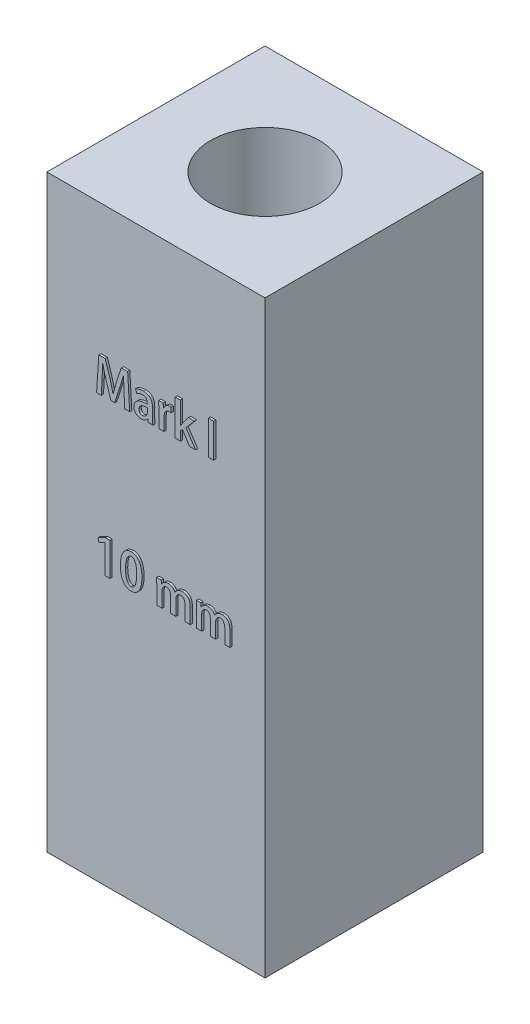
from build123d import *

# Parameters (mm, degrees)
CROQUIS1_W              = 10
CROQUIS1_H              = 10
CROQUIS1_R              = 2.5
SALIENTE_EXTRUIR1_DEPTH = 27
CROQUIS2_2_W            = 0.238171994
CROQUIS2_2_H            = 1.552222223
SALIENTE_EXTRUIR2_DEPTH = 0.1


with BuildPart() as part:
    # Croquis1 → Saliente-Extruir1 (new body)
    with BuildSketch(Plane(origin=(0, 0, 0), x_dir=(1, 0, 0), z_dir=(0, 1, 0))):
        Rectangle(CROQUIS1_W, CROQUIS1_H)
        Circle(CROQUIS1_R, mode=Mode.SUBTRACT)
    extrude(amount=SALIENTE_EXTRUIR1_DEPTH)

    # Croquis2<2> → Saliente-Extruir2 (add)
    # profile 1 of 9: a face of its own
    with BuildSketch(Plane.XY.offset(5)):
        with BuildLine():
            Line((-1.196299168, 21.029080524), (-1.489029741, 21.029080524))
            Line((-1.489029741, 21.029080524), (-1.713120041, 20.346907093))
            add(Edge.make_bspline(
                [(-1.713120041, 20.346907093), (-1.727697615, 20.299716085), (-1.756231951, 20.207343783), (-1.795341625, 20.070753521), (-1.829992127, 19.939079232), (-1.850660973, 19.852657221), (-1.860771731, 19.810381416)],
                knots=[0, 0, 0, 0, 1.06482216, 2.08429696, 3.06287894, 4, 4, 4, 4], degree=3))
            Line((-1.860771731, 19.810381416), (-1.866551238, 19.810381416))
            add(Edge.make_bspline(
                [(-1.866551238, 19.810381416), (-1.876481422, 19.853051166), (-1.896683618, 19.939859498), (-1.93070374, 20.071488595), (-1.967459767, 20.207101232), (-1.994351955, 20.298408277), (-2.008015817, 20.344801184)],
                knots=[0, 0, 0, 0, 0.950771496, 1.934271678, 2.950408035, 4, 4, 4, 4], degree=3))
            Line((-2.008015817, 20.344801184), (-2.225903251, 21.029080524))
            Line((-2.225903251, 21.029080524), (-2.516614993, 21.029080524))
            Line((-2.516614993, 21.029080524), (-2.621630897, 19.479409339))
            Line((-2.621630897, 19.479409339), (-2.403560427, 19.479409339))
            Line((-2.403560427, 19.479409339), (-2.36924029, 20.115225551))
            add(Edge.make_bspline(
                [(-2.36924029, 20.115225551), (-2.366142688, 20.170919846), (-2.35989255, 20.283296133), (-2.353809897, 20.423803434), (-2.348367501, 20.535729765), (-2.345730048, 20.61699773), (-2.342790327, 20.695298568), (-2.341738393, 20.746445045), (-2.341221555, 20.771574379)],
                knots=[0, 0, 0, 0, 1.528265809, 3.083634274, 3.853229214, 4.59840858, 5.311368824, 6, 6, 6, 6], degree=3))
            Line((-2.341221555, 20.771574379), (-2.334920154, 20.771597581))
            add(Edge.make_bspline(
                [(-2.334920154, 20.771597581), (-2.324589296, 20.723617077), (-2.303631025, 20.626278754), (-2.266531143, 20.479508668), (-2.225758304, 20.329473172), (-2.195122831, 20.22906041), (-2.179605039, 20.178198314)],
                knots=[0, 0, 0, 0, 0.959753872, 1.947058171, 2.960122984, 4, 4, 4, 4], degree=3))
            Line((-2.179605039, 20.178198314), (-1.967492815, 19.493601312))
            Line((-1.967492815, 19.493601312), (-1.791854471, 19.493601312))
            Line((-1.791854471, 19.493601312), (-1.561707676, 20.192452732))
            add(Edge.make_bspline(
                [(-1.561707676, 20.192452732), (-1.545557325, 20.241909213), (-1.513574545, 20.339848618), (-1.469197981, 20.486028271), (-1.427941936, 20.629553544), (-1.402746733, 20.724599981), (-1.390294614, 20.771574379)],
                knots=[0, 0, 0, 0, 1.033513873, 2.046682856, 3.034620343, 4, 4, 4, 4], degree=3))
            Line((-1.390294614, 20.771574379), (-1.384050501, 20.771597581))
            add(Edge.make_bspline(
                [(-1.384050501, 20.771597581), (-1.384147418, 20.746657815), (-1.384345026, 20.695806648), (-1.383338746, 20.618262138), (-1.381707988, 20.538078238), (-1.377545118, 20.428380993), (-1.371719332, 20.291107159), (-1.366485475, 20.18142271), (-1.363896272, 20.12716152)],
                knots=[0, 0, 0, 0, 0.69615936, 1.419440619, 2.164688967, 2.934803833, 4.483639269, 6, 6, 6, 6], degree=3))
            Line((-1.363896272, 20.12716152), (-1.32954205, 19.479409339))
            Line((-1.32954205, 19.479409339), (-1.103432918, 19.479409339))
            Line((-1.103432918, 19.479409339), (-1.196299168, 21.029080524))
        make_face()
    # profile 2 of 9: a face of its own
    with BuildSketch(Plane.XY.offset(5)):
        with BuildLine():
            add(Edge.make_bspline(
                [(-0.053952166, 20.155506797), (-0.053933683, 20.171094279), (-0.053897286, 20.201789221), (-0.057518774, 20.247008773), (-0.063893546, 20.290439821), (-0.073214651, 20.332080632), (-0.085936266, 20.371763587), (-0.101413142, 20.409687835), (-0.120056057, 20.445711117), (-0.141545368, 20.479861857), (-0.167086723, 20.511273005), (-0.197339407, 20.538867014), (-0.232386885, 20.562185402), (-0.272154981, 20.581216365), (-0.316470833, 20.596407), (-0.365308531, 20.607712644), (-0.418720262, 20.615108287), (-0.45586616, 20.61654487), (-0.475152092, 20.617290736)],
                knots=[0, 0, 0, 0, 1.04529413, 2.058397975, 3.039753549, 3.988049356, 4.917306062, 5.832005784, 6.732558164, 7.634995369, 8.534400609, 9.439717093, 10.371077683, 11.347885902, 12.389132223, 13.507522911, 14.705920534, 16, 16, 16, 16], degree=3))
            add(Edge.make_bspline(
                [(-0.475152092, 20.617290736), (-0.492957595, 20.616816764), (-0.528048962, 20.615882654), (-0.579600467, 20.61088989), (-0.629120436, 20.602765232), (-0.676037595, 20.591206125), (-0.720086934, 20.577835591), (-0.760725874, 20.56297161), (-0.797576215, 20.546416367), (-0.820085609, 20.533481991), (-0.830943079, 20.527243058)],
                knots=[0, 0, 0, 0, 1.151566781, 2.269526023, 3.346377101, 4.393757963, 5.391790339, 6.321988655, 7.190606464, 8, 8, 8, 8], degree=3))
            Line((-0.830943079, 20.527243058), (-0.781123083, 20.369063254))
            add(Edge.make_bspline(
                [(-0.781123083, 20.369063254), (-0.77171247, 20.37510656), (-0.75272953, 20.387297021), (-0.722239537, 20.403059962), (-0.690103274, 20.417263833), (-0.656139477, 20.428702506), (-0.621351216, 20.438541683), (-0.585956767, 20.445552861), (-0.550147937, 20.449783122), (-0.526200151, 20.450385225), (-0.514162975, 20.450687867)],
                knots=[0, 0, 0, 0, 0.947728913, 1.911743672, 2.906591377, 3.923705885, 4.947352295, 5.969890554, 6.979580645, 8, 8, 8, 8], degree=3))
            add(Edge.make_bspline(
                [(-0.514162975, 20.450687867), (-0.501813894, 20.449873349), (-0.478242904, 20.448318659), (-0.444972946, 20.442010936), (-0.415449317, 20.43362517), (-0.389446639, 20.42296027), (-0.367418177, 20.408938358), (-0.348994114, 20.39252782), (-0.334418974, 20.373321038), (-0.321472296, 20.344609444), (-0.310378364, 20.308152502), (-0.300596189, 20.265632707), (-0.296081909, 20.224913524), (-0.297364519, 20.198636491), (-0.297989886, 20.185824502)],
                knots=[0, 0, 0, 0, 1.124941475, 2.147203117, 3.073276344, 3.914150165, 4.693859246, 5.436944029, 6.148486199, 6.868538222, 8.288979618, 9.609682438, 10.834544209, 12, 12, 12, 12], degree=3))
            add(Edge.make_bspline(
                [(-0.297989886, 20.185824502), (-0.320678653, 20.185539999), (-0.365025123, 20.184983922), (-0.429782822, 20.180745531), (-0.490876774, 20.172779945), (-0.548357177, 20.161890924), (-0.60242818, 20.148446821), (-0.652727709, 20.130932907), (-0.699627981, 20.11078697), (-0.742785665, 20.087455124), (-0.78181461, 20.060849193), (-0.815831886, 20.03054531), (-0.844514985, 19.996643678), (-0.868702711, 19.959781778), (-0.887106432, 19.919009882), (-0.900985991, 19.875142448), (-0.90956491, 19.827714103), (-0.911105263, 19.794968866), (-0.911897994, 19.778116776)],
                knots=[0, 0, 0, 0, 1.312583045, 2.565517338, 3.751913568, 4.874585872, 5.948775456, 6.97196923, 7.952367169, 8.899011352, 9.80588498, 10.679130641, 11.525793372, 12.368308044, 13.221239438, 14.104974037, 15.024739096, 16, 16, 16, 16], degree=3))
            add(Edge.make_bspline(
                [(-0.911897994, 19.778116776), (-0.911473645, 19.767156476), (-0.910641021, 19.745651047), (-0.906633242, 19.713979761), (-0.899372869, 19.68374055), (-0.890222197, 19.654513549), (-0.877670348, 19.62680416), (-0.862708273, 19.600423672), (-0.845267409, 19.575176501), (-0.825103672, 19.551624148), (-0.802677089, 19.5297669), (-0.777493306, 19.511004679), (-0.750365313, 19.494799783), (-0.721140808, 19.481133874), (-0.689496917, 19.470690929), (-0.655746236, 19.462757034), (-0.61969828, 19.457773568), (-0.594937614, 19.456639732), (-0.582212035, 19.456057004)],
                knots=[0, 0, 0, 0, 1.019558823, 2.000497171, 2.961865832, 3.90763667, 4.843526869, 5.78386522, 6.724423229, 7.691661655, 8.662438953, 9.629634663, 10.603980382, 11.596308817, 12.622532153, 13.696327026, 14.81604254, 16, 16, 16, 16], degree=3))
            add(Edge.make_bspline(
                [(-0.582212035, 19.456057004), (-0.565841961, 19.456612545), (-0.533867175, 19.457697653), (-0.487707844, 19.466370755), (-0.444274735, 19.478668363), (-0.404395551, 19.496746116), (-0.368185088, 19.518848134), (-0.335215096, 19.543532898), (-0.306123182, 19.571455519), (-0.289918348, 19.592526447), (-0.281857566, 19.603007774)],
                knots=[0, 0, 0, 0, 1.130657597, 2.208452709, 3.237069398, 4.244418774, 5.223812689, 6.164576675, 7.087004055, 8, 8, 8, 8], degree=3))
            Line((-0.281857566, 19.603007774), (-0.275253111, 19.603065349))
            Line((-0.275253111, 19.603065349), (-0.258392086, 19.477618228))
            Line((-0.258392086, 19.477618228), (-0.037732768, 19.477618228))
            add(Edge.make_bspline(
                [(-0.037732768, 19.477618228), (-0.040897849, 19.496597162), (-0.047581659, 19.536675639), (-0.051747532, 19.600214154), (-0.05403103, 19.668395576), (-0.054172931, 19.715246615), (-0.054245195, 19.739105893)],
                knots=[0, 0, 0, 0, 0.879539962, 1.857355241, 2.908840502, 4, 4, 4, 4], degree=3))
            Line((-0.054245195, 19.739105893), (-0.053952166, 20.155506797))
        make_face()
        with BuildLine():
            add(Edge.make_bspline(
                [(-0.292123874, 19.85181673), (-0.292565708, 19.843563522), (-0.293425459, 19.827503836), (-0.297118337, 19.804055524), (-0.302157272, 19.781770952), (-0.30974875, 19.760760078), (-0.318698035, 19.74068664), (-0.329992125, 19.721921664), (-0.342912234, 19.704123049), (-0.357899957, 19.687847624), (-0.374138828, 19.672946445), (-0.391614279, 19.660011148), (-0.409781112, 19.64873434), (-0.42910308, 19.639619265), (-0.449388406, 19.632186668), (-0.470747733, 19.627011652), (-0.493045123, 19.623714024), (-0.508187646, 19.623016293), (-0.515922865, 19.622659873)],
                knots=[0, 0, 0, 0, 1.1127689, 2.165305488, 3.194083487, 4.185588777, 5.169981375, 6.15040018, 7.13046498, 8.12816315, 9.12586132, 10.095335325, 11.053196287, 12.001774197, 12.968470205, 13.958837393, 14.957317833, 16, 16, 16, 16], degree=3))
            add(Edge.make_bspline(
                [(-0.515922865, 19.622659873), (-0.526348867, 19.622986841), (-0.54677129, 19.623627305), (-0.576043385, 19.632361798), (-0.60296697, 19.646059855), (-0.627344866, 19.665200397), (-0.647756744, 19.69069521), (-0.66238159, 19.722675436), (-0.671428419, 19.760622731), (-0.672737046, 19.787936502), (-0.673432972, 19.802461914)],
                knots=[0, 0, 0, 0, 0.925162071, 1.812204857, 2.691873356, 3.602553412, 4.549923018, 5.56994314, 6.707700436, 8, 8, 8, 8], degree=3))
            add(Edge.make_bspline(
                [(-0.673432972, 19.802461914), (-0.672504166, 19.814124606), (-0.670710258, 19.836650073), (-0.664133484, 19.868903199), (-0.653394707, 19.897940713), (-0.639623735, 19.923993766), (-0.622452724, 19.947140376), (-0.60120143, 19.966485377), (-0.576944474, 19.983265842), (-0.53961783, 20.000360001), (-0.489300298, 20.016507544), (-0.426242327, 20.030369907), (-0.360162716, 20.037877182), (-0.315313119, 20.037760195), (-0.292416903, 20.037700472)],
                knots=[0, 0, 0, 0, 0.831751151, 1.606454387, 2.332498033, 3.02628555, 3.696675427, 4.370806108, 5.061344671, 5.786088267, 7.281491765, 8.811961156, 10.372470837, 12, 12, 12, 12], degree=3))
            Line((-0.292416903, 20.037700472), (-0.292123874, 19.85181673))
        make_face(mode=Mode.SUBTRACT)
    # profile 3 of 9: a face of its own
    with BuildSketch(Plane.XY.offset(5)):
        with BuildLine():
            add(Edge.make_bspline(
                [(0.798083824, 20.611553336), (0.788539911, 20.613210649), (0.769047446, 20.61659554), (0.749267113, 20.617055819), (0.739171639, 20.617290736)],
                knots=[0, 0, 0, 0, 0.97924127, 2, 2, 2, 2], degree=3))
            add(Edge.make_bspline(
                [(0.739171639, 20.617290736), (0.723847826, 20.616453707), (0.693455305, 20.614793584), (0.648964014, 20.602845287), (0.606665471, 20.583392189), (0.566554279, 20.557213359), (0.529366688, 20.524773207), (0.497456952, 20.485421616), (0.469512451, 20.440761818), (0.456024619, 20.407616391), (0.449083192, 20.39055831)],
                knots=[0, 0, 0, 0, 0.938175605, 1.860732817, 2.801619752, 3.780189859, 4.786007179, 5.811395864, 6.873648904, 8, 8, 8, 8], degree=3))
            Line((0.449083192, 20.39055831), (0.440870375, 20.390609296))
            Line((0.440870375, 20.390609296), (0.432657557, 20.593479237))
            Line((0.432657557, 20.593479237), (0.225386747, 20.593479237))
            add(Edge.make_bspline(
                [(0.225386747, 20.593479237), (0.226735788, 20.567494093), (0.229489608, 20.514450168), (0.231570538, 20.432608946), (0.233218682, 20.345688049), (0.233208637, 20.28584588), (0.233203418, 20.254753506)],
                knots=[0, 0, 0, 0, 0.921405029, 1.880880017, 2.898962507, 4, 4, 4, 4], degree=3))
            Line((0.233203418, 20.254753506), (0.233496446, 19.478268161))
            Line((0.233496446, 19.478268161), (0.47166844, 19.478268161))
            Line((0.47166844, 19.478268161), (0.47166844, 20.070276186))
            add(Edge.make_bspline(
                [(0.47166844, 20.070276186), (0.472033638, 20.082301823), (0.47274468, 20.105715785), (0.475848675, 20.139945871), (0.481442585, 20.172189381), (0.489050183, 20.202603479), (0.498765514, 20.231145838), (0.510353047, 20.258001793), (0.524589729, 20.282599339), (0.540410607, 20.305428882), (0.558265096, 20.325823855), (0.577615533, 20.344024212), (0.599106245, 20.358987052), (0.621896445, 20.371773551), (0.646567142, 20.381305855), (0.672514788, 20.388861822), (0.700215782, 20.393190292), (0.719212277, 20.393972346), (0.728905617, 20.394371404)],
                knots=[0, 0, 0, 0, 1.241840886, 2.417868999, 3.544527356, 4.616704577, 5.650820151, 6.654086497, 7.630544836, 8.5797601, 9.516878827, 10.423948895, 11.314471818, 12.213419717, 13.114913654, 14.038234368, 14.998969914, 16, 16, 16, 16], degree=3))
            add(Edge.make_bspline(
                [(0.728905617, 20.394371404), (0.741154195, 20.394190832), (0.764272582, 20.393850016), (0.787101102, 20.390214468), (0.797834621, 20.388505106)],
                knots=[0, 0, 0, 0, 1.059639438, 2, 2, 2, 2], degree=3))
            Line((0.797834621, 20.388505106), (0.798083824, 20.611553336))
        make_face()
    # profile 4 of 9: a face of its own
    with BuildSketch(Plane.XY.offset(5)):
        with BuildLine():
            Line((1.473955281, 20.134031505), (1.867275682, 20.594647054))
            Line((1.867275682, 20.594647054), (1.589518491, 20.594647054))
            Line((1.589518491, 20.594647054), (1.311761301, 20.221284671))
            add(Edge.make_bspline(
                [(1.311761301, 20.221284671), (1.297091766, 20.200201073), (1.267485244, 20.157649487), (1.240155846, 20.113600536), (1.226367706, 20.091377101)],
                knots=[0, 0, 0, 0, 0.99096644, 2, 2, 2, 2], degree=3))
            Line((1.226367706, 20.091377101), (1.222554612, 20.091419494))
            Line((1.222554612, 20.091419494), (1.222554612, 21.103899887))
            Line((1.222554612, 21.103899887), (0.984382618, 21.103899887))
            Line((0.984382618, 21.103899887), (0.984382618, 19.476589047))
            Line((0.984382618, 19.476589047), (1.222554612, 19.476589047))
            Line((1.222554612, 19.476589047), (1.222554612, 19.878359438))
            Line((1.222554612, 19.878359438), (1.313788726, 19.989962325))
            Line((1.313788726, 19.989962325), (1.634121836, 19.476589047))
            Line((1.634121836, 19.476589047), (1.9179613, 19.476589047))
            Line((1.9179613, 19.476589047), (1.473955281, 20.134031505))
        make_face()
    # profile 5 of 9: a face of its own
    with BuildSketch(Plane.XY.offset(5)):
        with Locations((2.624013114, 20.252700159)):
            Rectangle(CROQUIS2_2_W, CROQUIS2_2_H)
    # profile 6 of 9: a face of its own
    with BuildSketch(Plane.XY.offset(5)):
        Polygon((-2.006255927, 12.406347497), (-2.006255927, 13.92454519), (-2.212803475, 13.92454519), (-2.558678757, 13.749288098), (-2.505965713, 13.578477993), (-2.248482771, 13.720397725), (-2.244427921, 13.720397725), (-2.244427921, 12.408653915), align=None)
    # profile 7 of 9: a face of its own
    with BuildSketch(Plane.XY.offset(5)):
        with BuildLine():
            add(Edge.make_bspline(
                [(-1.042610748, 12.388015029), (-1.023441122, 12.388668567), (-0.98588999, 12.389948775), (-0.931195762, 12.399835728), (-0.879832101, 12.415978098), (-0.831710785, 12.438457433), (-0.787149685, 12.467554445), (-0.745721165, 12.502799553), (-0.707814724, 12.5444702), (-0.673440827, 12.592376919), (-0.642631058, 12.646208836), (-0.616009253, 12.706103224), (-0.593480897, 12.771790365), (-0.575218335, 12.843342421), (-0.560533813, 12.920721581), (-0.550241449, 13.003998439), (-0.54368267, 13.093088936), (-0.542784248, 13.154386241), (-0.542321207, 13.18597853)],
                knots=[0, 0, 0, 0, 0.870696281, 1.705595656, 2.516350062, 3.311357778, 4.111130694, 4.927465531, 5.776524699, 6.664348225, 7.60171378, 8.590083443, 9.638235951, 10.753539253, 11.94293492, 13.214798286, 14.564522568, 16, 16, 16, 16], degree=3))
            add(Edge.make_bspline(
                [(-0.542321207, 13.18597853), (-0.542584319, 13.214734989), (-0.543096817, 13.270747529), (-0.549224638, 13.352378809), (-0.558456615, 13.429549109), (-0.571347645, 13.502240199), (-0.588912941, 13.570340702), (-0.609456747, 13.634097802), (-0.634118318, 13.693294542), (-0.662482618, 13.747689511), (-0.694461981, 13.796910593), (-0.730845348, 13.839750764), (-0.77061279, 13.876637806), (-0.814472061, 13.906850978), (-0.862176087, 13.930571221), (-0.913765931, 13.94746045), (-0.968924349, 13.958640941), (-1.007072872, 13.960534622), (-1.026584125, 13.961503155)],
                knots=[0, 0, 0, 0, 1.348598241, 2.626833012, 3.837323855, 4.993252023, 6.086653137, 7.133754439, 8.132822275, 9.090804279, 10.007900934, 10.879914043, 11.720575117, 12.54490278, 13.369396272, 14.210545074, 15.084774353, 16, 16, 16, 16], degree=3))
            add(Edge.make_bspline(
                [(-1.026584125, 13.961503155), (-1.045987332, 13.96069907), (-1.083880009, 13.959128768), (-1.138990672, 13.948938037), (-1.190724204, 13.9325674), (-1.239070521, 13.909414026), (-1.283926186, 13.879755999), (-1.325636708, 13.843916915), (-1.363842335, 13.801671798), (-1.398421154, 13.753228797), (-1.429551012, 13.699139804), (-1.456413506, 13.639333002), (-1.47929517, 13.574170719), (-1.497937263, 13.50362709), (-1.512389609, 13.427738432), (-1.523320041, 13.34658507), (-1.52960997, 13.25989336), (-1.530777696, 13.200263055), (-1.531379086, 13.169552895)],
                knots=[0, 0, 0, 0, 0.885786215, 1.729858878, 2.550092024, 3.356753299, 4.168966232, 4.998392219, 5.861110803, 6.763026954, 7.71096382, 8.705887709, 9.752087664, 10.860900304, 12.034055661, 13.277157086, 14.597710659, 16, 16, 16, 16], degree=3))
            add(Edge.make_bspline(
                [(-1.531379086, 13.169552895), (-1.531024787, 13.140501089), (-1.530334433, 13.083893558), (-1.523823588, 13.001301514), (-1.514580324, 12.923279856), (-1.500677711, 12.849926102), (-1.483217094, 12.781192564), (-1.461876762, 12.716876964), (-1.436366053, 12.657370431), (-1.407435614, 12.602518435), (-1.374788202, 12.55315179), (-1.33826174, 12.509807714), (-1.297811719, 12.47309317), (-1.253640109, 12.442931612), (-1.2061139, 12.418783845), (-1.154739847, 12.401972103), (-1.09999629, 12.390696937), (-1.062132522, 12.388827356), (-1.042610748, 12.388015029)],
                knots=[0, 0, 0, 0, 1.353423849, 2.637150346, 3.858261108, 5.012665895, 6.113189956, 7.160539399, 8.16670341, 9.126620219, 10.046469106, 10.919123896, 11.760946034, 12.583565319, 13.404631502, 14.235884548, 15.095383165, 16, 16, 16, 16], degree=3))
        make_face()
        with BuildLine():
            add(Edge.make_bspline(
                [(-1.038573658, 12.572510681), (-1.048520509, 12.573047376), (-1.068139332, 12.574105934), (-1.096395981, 12.582519637), (-1.122978599, 12.595205927), (-1.147481539, 12.613225166), (-1.170301727, 12.63584659), (-1.191135695, 12.663490546), (-1.210091031, 12.695964331), (-1.227265481, 12.7330526), (-1.242721118, 12.774433898), (-1.256232578, 12.819987548), (-1.267108258, 12.869749213), (-1.276551525, 12.923455483), (-1.283773791, 12.981313842), (-1.28895721, 13.043155672), (-1.292234462, 13.109095014), (-1.292682768, 13.154394313), (-1.292914064, 13.177765713)],
                knots=[0, 0, 0, 0, 0.666398031, 1.31438028, 1.962893771, 2.634846584, 3.344681637, 4.112349672, 4.950647476, 5.86347927, 6.851779693, 7.912578033, 9.049075701, 10.267961701, 11.570849897, 12.960254545, 14.431695278, 16, 16, 16, 16], degree=3))
            add(Edge.make_bspline(
                [(-1.292914064, 13.177765713), (-1.292622709, 13.201140128), (-1.292056668, 13.246551624), (-1.287981905, 13.312465532), (-1.282740373, 13.374255788), (-1.274711836, 13.431780399), (-1.265042841, 13.4852283), (-1.252529034, 13.534301133), (-1.238743865, 13.579446585), (-1.222273133, 13.620178048), (-1.204303884, 13.656579804), (-1.184611463, 13.688271914), (-1.16346553, 13.715241355), (-1.140869395, 13.737593209), (-1.116482995, 13.754937469), (-1.090622914, 13.767415547), (-1.063236138, 13.775492128), (-1.044335859, 13.776499605), (-1.034796942, 13.777008076)],
                knots=[0, 0, 0, 0, 1.581052361, 3.071646956, 4.466225399, 5.774778899, 6.999321057, 8.13822646, 9.198772947, 10.189899711, 11.106816715, 11.941785511, 12.709246862, 13.420164871, 14.084452052, 14.723397775, 15.355702508, 16, 16, 16, 16], degree=3))
            add(Edge.make_bspline(
                [(-1.034796942, 13.777008076), (-1.024082287, 13.776313321), (-1.003022702, 13.774947785), (-0.972800728, 13.76638471), (-0.944707798, 13.753432307), (-0.919139232, 13.735056947), (-0.895875205, 13.711930723), (-0.874952704, 13.683869193), (-0.856144601, 13.651087368), (-0.840064855, 13.613438621), (-0.82572754, 13.57175489), (-0.813621983, 13.526216041), (-0.802984744, 13.477106406), (-0.794595266, 13.42431815), (-0.788268821, 13.367833695), (-0.783551842, 13.307772841), (-0.780983975, 13.243979965), (-0.780659703, 13.20025537), (-0.780492914, 13.177765713)],
                knots=[0, 0, 0, 0, 0.720966059, 1.417054204, 2.100078545, 2.793954457, 3.524557493, 4.299796832, 5.143005199, 6.062454772, 7.05102079, 8.107851098, 9.232113941, 10.431958672, 11.703767055, 13.056962832, 14.486254779, 16, 16, 16, 16], degree=3))
            add(Edge.make_bspline(
                [(-0.780492914, 13.177765713), (-0.780469731, 13.157623598), (-0.780424139, 13.118012006), (-0.782427144, 13.059597367), (-0.786575172, 13.003450871), (-0.792318735, 12.949510785), (-0.800312724, 12.897865092), (-0.809918226, 12.848335321), (-0.821287445, 12.801007253), (-0.834591758, 12.756349983), (-0.849863906, 12.715214572), (-0.868505802, 12.679000781), (-0.889548341, 12.647756022), (-0.913810531, 12.621747233), (-0.941170121, 12.601388606), (-0.970905635, 12.585635814), (-1.003833642, 12.575863343), (-1.026815962, 12.573550594), (-1.038573658, 12.572510681)],
                knots=[0, 0, 0, 0, 1.341939408, 2.639065411, 3.893110861, 5.09230624, 6.252216656, 7.373906837, 8.453023627, 9.493766498, 10.477323239, 11.371762395, 12.201113983, 12.97990739, 13.729039495, 14.463267275, 15.211379073, 16, 16, 16, 16], degree=3))
        make_face(mode=Mode.SUBTRACT)
    # profile 8 of 9: a face of its own
    with BuildSketch(Plane.XY.offset(5)):
        with BuildLine():
            add(Edge.make_bspline(
                [(1.673086029, 13.090464425), (1.67215772, 13.111077003), (1.670365963, 13.150861952), (1.663815589, 13.208116919), (1.654840245, 13.260791645), (1.641836074, 13.308435454), (1.626213175, 13.351330131), (1.607054541, 13.389270084), (1.584725268, 13.42252538), (1.55905493, 13.450782133), (1.531172757, 13.474285603), (1.502990684, 13.495127157), (1.473861975, 13.512414251), (1.444116532, 13.526724485), (1.413415931, 13.53741003), (1.381877872, 13.544208935), (1.34978937, 13.548726162), (1.328163308, 13.548586131), (1.317295329, 13.54851576)],
                knots=[0, 0, 0, 0, 1.513261231, 2.920790482, 4.225039661, 5.429095985, 6.538902965, 7.568588871, 8.539409605, 9.468669045, 10.358677973, 11.210859535, 12.037483604, 12.839564471, 13.628941055, 14.4154775, 15.203712731, 16, 16, 16, 16], degree=3))
            add(Edge.make_bspline(
                [(1.317295329, 13.54851576), (1.298079599, 13.547757116), (1.260829637, 13.546286475), (1.207305651, 13.535705198), (1.157840201, 13.519457225), (1.112968522, 13.495943442), (1.072406348, 13.466676206), (1.034744112, 13.433531571), (1.00106113, 13.395010462), (0.981834694, 13.366489389), (0.972063678, 13.35199477)],
                knots=[0, 0, 0, 0, 1.108126197, 2.148118191, 3.136426768, 4.10280475, 5.057637098, 6.016626622, 6.992035069, 8, 8, 8, 8], degree=3))
            Line((0.972063678, 13.35199477), (0.968006824, 13.352002217))
            add(Edge.make_bspline(
                [(0.968006824, 13.352002217), (0.961392471, 13.366707133), (0.948448558, 13.39548382), (0.921685547, 13.434177719), (0.890103124, 13.46783246), (0.853781486, 13.49650351), (0.813254282, 13.519473905), (0.768881432, 13.535897487), (0.721292811, 13.546591562), (0.688291365, 13.547864722), (0.671415895, 13.54851576)],
                knots=[0, 0, 0, 0, 1.020955632, 1.99795227, 2.96752067, 3.938931661, 4.92195175, 5.909051468, 6.930781959, 8, 8, 8, 8], degree=3))
            add(Edge.make_bspline(
                [(0.671415895, 13.54851576), (0.6521002, 13.547449292), (0.61511286, 13.545407129), (0.562388939, 13.534511912), (0.515249124, 13.517070985), (0.474221835, 13.492789433), (0.438592589, 13.464778075), (0.407276231, 13.434690478), (0.380074943, 13.402786337), (0.365787507, 13.379377136), (0.3587422, 13.367833775)],
                knots=[0, 0, 0, 0, 1.224631561, 2.345029053, 3.39800305, 4.394808606, 5.352867572, 6.264332918, 7.144121535, 8, 8, 8, 8], degree=3))
            Line((0.3587422, 13.367833775), (0.352736119, 13.368050897))
            Line((0.352736119, 13.368050897), (0.340200343, 13.525358204))
            Line((0.340200343, 13.525358204), (0.131525976, 13.525358204))
            add(Edge.make_bspline(
                [(0.131525976, 13.525358204), (0.132493307, 13.502377927), (0.134468753, 13.455448483), (0.136595679, 13.39589831), (0.138368214, 13.345843903), (0.138685915, 13.305454338), (0.139522755, 13.262536495), (0.139403866, 13.233104947), (0.139342646, 13.217949856)],
                knots=[0, 0, 0, 0, 1.346187736, 2.749133221, 3.487683855, 4.277464658, 5.113020504, 6, 6, 6, 6], degree=3))
            Line((0.139342646, 13.217949856), (0.139635675, 12.415331985))
            Line((0.139635675, 12.415331985), (0.377807669, 12.415331985))
            Line((0.377807669, 12.415331985), (0.377807669, 13.09249185))
            add(Edge.make_bspline(
                [(0.377807669, 13.09249185), (0.378348178, 13.103232166), (0.379399057, 13.124113934), (0.383309839, 13.154351077), (0.388603781, 13.182714145), (0.396741567, 13.208921168), (0.4063118, 13.233312822), (0.417749669, 13.255813951), (0.431292194, 13.276229203), (0.446897459, 13.294305112), (0.463581554, 13.3102841), (0.480601331, 13.324459513), (0.498012247, 13.336630126), (0.515924601, 13.346708092), (0.534444651, 13.354404904), (0.553412463, 13.359518265), (0.572608886, 13.363404703), (0.585650228, 13.363814309), (0.592220869, 13.364020681)],
                knots=[0, 0, 0, 0, 1.345028047, 2.615059288, 3.812240957, 4.950008049, 6.042686379, 7.08768926, 8.102172383, 9.099996684, 10.068982838, 10.989984122, 11.868914175, 12.723236376, 13.556990843, 14.370301474, 15.178906315, 16, 16, 16, 16], degree=3))
            add(Edge.make_bspline(
                [(0.592220869, 13.364020681), (0.600061394, 13.363617765), (0.615262384, 13.362836603), (0.637138995, 13.358672907), (0.657348023, 13.35218983), (0.676014706, 13.343336594), (0.693028444, 13.332125134), (0.70865157, 13.318820156), (0.722008049, 13.302722765), (0.73839249, 13.2784282), (0.754230828, 13.243127456), (0.768611103, 13.196390913), (0.776167652, 13.143983411), (0.777106302, 13.107390927), (0.777595893, 13.088304665)],
                knots=[0, 0, 0, 0, 0.755950668, 1.465615932, 2.139074498, 2.796588983, 3.449971736, 4.097964407, 4.76639413, 5.458962618, 6.917416126, 8.473425038, 10.160574856, 12, 12, 12, 12], degree=3))
            Line((0.777595893, 13.088304665), (0.777888921, 12.415331985))
            Line((0.777888921, 12.415331985), (1.016060629, 12.415331985))
            Line((1.016060629, 12.415331985), (1.016060629, 13.104656398))
            add(Edge.make_bspline(
                [(1.016060629, 13.104656398), (1.016353399, 13.114571964), (1.016923084, 13.133866112), (1.021025984, 13.161890797), (1.026417888, 13.188429555), (1.034052204, 13.213245523), (1.043384886, 13.236423752), (1.055028985, 13.257615396), (1.06812976, 13.277456637), (1.08339485, 13.295181398), (1.099920174, 13.311035697), (1.117023788, 13.325066276), (1.13481524, 13.336940192), (1.153152668, 13.346742493), (1.172119183, 13.354409104), (1.191853198, 13.359596926), (1.211950274, 13.363375547), (1.225665744, 13.363805556), (1.232527319, 13.364020681)],
                knots=[0, 0, 0, 0, 1.267233675, 2.465839704, 3.615673463, 4.726804397, 5.780700789, 6.804285049, 7.813184962, 8.815168933, 9.787633234, 10.738404153, 11.639821434, 12.517791614, 13.392909498, 14.248069017, 15.123543946, 16, 16, 16, 16], degree=3))
            add(Edge.make_bspline(
                [(1.232527319, 13.364020681), (1.24104506, 13.363598871), (1.257591622, 13.362779462), (1.281637079, 13.358845879), (1.303617687, 13.351507281), (1.324280038, 13.342725949), (1.342511559, 13.330226053), (1.359492705, 13.315984048), (1.374201521, 13.298535998), (1.387325849, 13.278934345), (1.398746755, 13.257167011), (1.408343734, 13.233402408), (1.416920116, 13.207997405), (1.423645135, 13.180618265), (1.428409127, 13.151460102), (1.4324143, 13.120568649), (1.434335708, 13.087743085), (1.434524513, 13.065232341), (1.434621293, 13.053693505)],
                knots=[0, 0, 0, 0, 0.979325905, 1.902438322, 2.786756391, 3.636233264, 4.470958944, 5.315074409, 6.175027208, 7.081388835, 8.020752095, 8.99258041, 10.022434341, 11.098284182, 12.226320848, 13.414468146, 14.674676153, 16, 16, 16, 16], degree=3))
            Line((1.434621293, 13.053693505), (1.434914035, 12.415331985))
            Line((1.434914035, 12.415331985), (1.673086029, 12.415331985))
            Line((1.673086029, 12.415331985), (1.673086029, 13.090464425))
        make_face()
    # profile 9 of 9: a face of its own
    with BuildSketch(Plane.XY.offset(5)):
        with BuildLine():
            add(Edge.make_bspline(
                [(3.493984996, 13.090464425), (3.493056687, 13.111077003), (3.49126493, 13.150861952), (3.484714556, 13.208116919), (3.475739212, 13.260791645), (3.462735041, 13.308435454), (3.447112142, 13.351330131), (3.427953508, 13.389270084), (3.405624235, 13.42252538), (3.379953897, 13.450782133), (3.352071724, 13.474285603), (3.323889651, 13.495127157), (3.294760942, 13.512414251), (3.2650155, 13.526724485), (3.234314898, 13.53741003), (3.202776839, 13.544208935), (3.170688337, 13.548726162), (3.149062275, 13.548586131), (3.138194296, 13.54851576)],
                knots=[0, 0, 0, 0, 1.513261231, 2.920790482, 4.225039661, 5.429095985, 6.538902965, 7.568588871, 8.539409605, 9.468669045, 10.358677973, 11.210859535, 12.037483604, 12.839564471, 13.628941055, 14.4154775, 15.203712731, 16, 16, 16, 16], degree=3))
            add(Edge.make_bspline(
                [(3.138194296, 13.54851576), (3.118978566, 13.547757116), (3.081728604, 13.546286475), (3.028204618, 13.535705198), (2.978739168, 13.519457225), (2.933867489, 13.495943442), (2.893305315, 13.466676206), (2.855643079, 13.433531571), (2.821960097, 13.395010462), (2.802733661, 13.366489389), (2.792962646, 13.35199477)],
                knots=[0, 0, 0, 0, 1.108126197, 2.148118191, 3.136426768, 4.10280475, 5.057637098, 6.016626622, 6.992035069, 8, 8, 8, 8], degree=3))
            Line((2.792962646, 13.35199477), (2.788905791, 13.352002217))
            add(Edge.make_bspline(
                [(2.788905791, 13.352002217), (2.782291438, 13.366707133), (2.769347526, 13.39548382), (2.742584514, 13.434177719), (2.711002091, 13.46783246), (2.674680453, 13.49650351), (2.634153249, 13.519473905), (2.589780399, 13.535897487), (2.542191778, 13.546591562), (2.509190332, 13.547864722), (2.492314862, 13.54851576)],
                knots=[0, 0, 0, 0, 1.020955632, 1.99795227, 2.96752067, 3.938931661, 4.92195175, 5.909051468, 6.930781959, 8, 8, 8, 8], degree=3))
            add(Edge.make_bspline(
                [(2.492314862, 13.54851576), (2.472999167, 13.547449292), (2.436011827, 13.545407129), (2.383287906, 13.534511912), (2.336148092, 13.517070985), (2.295120802, 13.492789433), (2.259491556, 13.464778075), (2.228175198, 13.434690478), (2.20097391, 13.402786337), (2.186686475, 13.379377136), (2.179641167, 13.367833775)],
                knots=[0, 0, 0, 0, 1.224631561, 2.345029053, 3.39800305, 4.394808606, 5.352867572, 6.264332918, 7.144121535, 8, 8, 8, 8], degree=3))
            Line((2.179641167, 13.367833775), (2.173635086, 13.368050897))
            Line((2.173635086, 13.368050897), (2.161099311, 13.525358204))
            Line((2.161099311, 13.525358204), (1.952424943, 13.525358204))
            add(Edge.make_bspline(
                [(1.952424943, 13.525358204), (1.953392274, 13.502377927), (1.95536772, 13.455448483), (1.957494646, 13.39589831), (1.959267181, 13.345843903), (1.959584882, 13.305454338), (1.960421722, 13.262536495), (1.960302833, 13.233104947), (1.960241613, 13.217949856)],
                knots=[0, 0, 0, 0, 1.346187736, 2.749133221, 3.487683855, 4.277464658, 5.113020504, 6, 6, 6, 6], degree=3))
            Line((1.960241613, 13.217949856), (1.960534642, 12.415331985))
            Line((1.960534642, 12.415331985), (2.198706636, 12.415331985))
            Line((2.198706636, 12.415331985), (2.198706636, 13.09249185))
            add(Edge.make_bspline(
                [(2.198706636, 13.09249185), (2.199247145, 13.103232166), (2.200298025, 13.124113934), (2.204208806, 13.154351077), (2.209502748, 13.182714145), (2.217640534, 13.208921168), (2.227210767, 13.233312822), (2.238648636, 13.255813951), (2.252191161, 13.276229203), (2.267796426, 13.294305112), (2.284480521, 13.3102841), (2.301500299, 13.324459513), (2.318911214, 13.336630126), (2.336823568, 13.346708092), (2.355343618, 13.354404904), (2.37431143, 13.359518265), (2.393507853, 13.363404703), (2.406549195, 13.363814309), (2.413119836, 13.364020681)],
                knots=[0, 0, 0, 0, 1.345028047, 2.615059288, 3.812240957, 4.950008049, 6.042686379, 7.08768926, 8.102172383, 9.099996684, 10.068982838, 10.989984122, 11.868914175, 12.723236376, 13.556990843, 14.370301474, 15.178906315, 16, 16, 16, 16], degree=3))
            add(Edge.make_bspline(
                [(2.413119836, 13.364020681), (2.420960361, 13.363617765), (2.436161351, 13.362836603), (2.458037962, 13.358672907), (2.47824699, 13.35218983), (2.496913673, 13.343336594), (2.513927411, 13.332125134), (2.529550537, 13.318820156), (2.542907016, 13.302722765), (2.559291457, 13.2784282), (2.575129795, 13.243127456), (2.58951007, 13.196390913), (2.597066619, 13.143983411), (2.598005269, 13.107390927), (2.59849486, 13.088304665)],
                knots=[0, 0, 0, 0, 0.755950668, 1.465615932, 2.139074498, 2.796588983, 3.449971736, 4.097964407, 4.76639413, 5.458962618, 6.917416126, 8.473425038, 10.160574856, 12, 12, 12, 12], degree=3))
            Line((2.59849486, 13.088304665), (2.598787888, 12.415331985))
            Line((2.598787888, 12.415331985), (2.836959596, 12.415331985))
            Line((2.836959596, 12.415331985), (2.836959596, 13.104656398))
            add(Edge.make_bspline(
                [(2.836959596, 13.104656398), (2.837252366, 13.114571964), (2.837822051, 13.133866112), (2.841924951, 13.161890797), (2.847316855, 13.188429555), (2.854951171, 13.213245523), (2.864283853, 13.236423752), (2.875927952, 13.257615396), (2.889028727, 13.277456637), (2.904293817, 13.295181398), (2.920819141, 13.311035697), (2.937922755, 13.325066276), (2.955714207, 13.336940192), (2.974051635, 13.346742493), (2.99301815, 13.354409104), (3.012752165, 13.359596926), (3.032849241, 13.363375547), (3.046564711, 13.363805556), (3.053426286, 13.364020681)],
                knots=[0, 0, 0, 0, 1.267233675, 2.465839704, 3.615673463, 4.726804397, 5.780700789, 6.804285049, 7.813184962, 8.815168933, 9.787633234, 10.738404153, 11.639821434, 12.517791614, 13.392909498, 14.248069017, 15.123543946, 16, 16, 16, 16], degree=3))
            add(Edge.make_bspline(
                [(3.053426286, 13.364020681), (3.061944027, 13.363598871), (3.078490589, 13.362779462), (3.102536046, 13.358845879), (3.124516654, 13.351507281), (3.145179005, 13.342725949), (3.163410526, 13.330226053), (3.180391672, 13.315984048), (3.195100488, 13.298535998), (3.208224816, 13.278934345), (3.219645722, 13.257167011), (3.229242701, 13.233402408), (3.237819083, 13.207997405), (3.244544102, 13.180618265), (3.249308094, 13.151460102), (3.253313267, 13.120568649), (3.255234675, 13.087743085), (3.25542348, 13.065232341), (3.25552026, 13.053693505)],
                knots=[0, 0, 0, 0, 0.979325905, 1.902438322, 2.786756391, 3.636233264, 4.470958944, 5.315074409, 6.175027208, 7.081388835, 8.020752095, 8.99258041, 10.022434341, 11.098284182, 12.226320848, 13.414468146, 14.674676153, 16, 16, 16, 16], degree=3))
            Line((3.25552026, 13.053693505), (3.255813002, 12.415331985))
            Line((3.255813002, 12.415331985), (3.493984996, 12.415331985))
            Line((3.493984996, 12.415331985), (3.493984996, 13.090464425))
        make_face()
    extrude(amount=SALIENTE_EXTRUIR2_DEPTH)


solid = part.part
